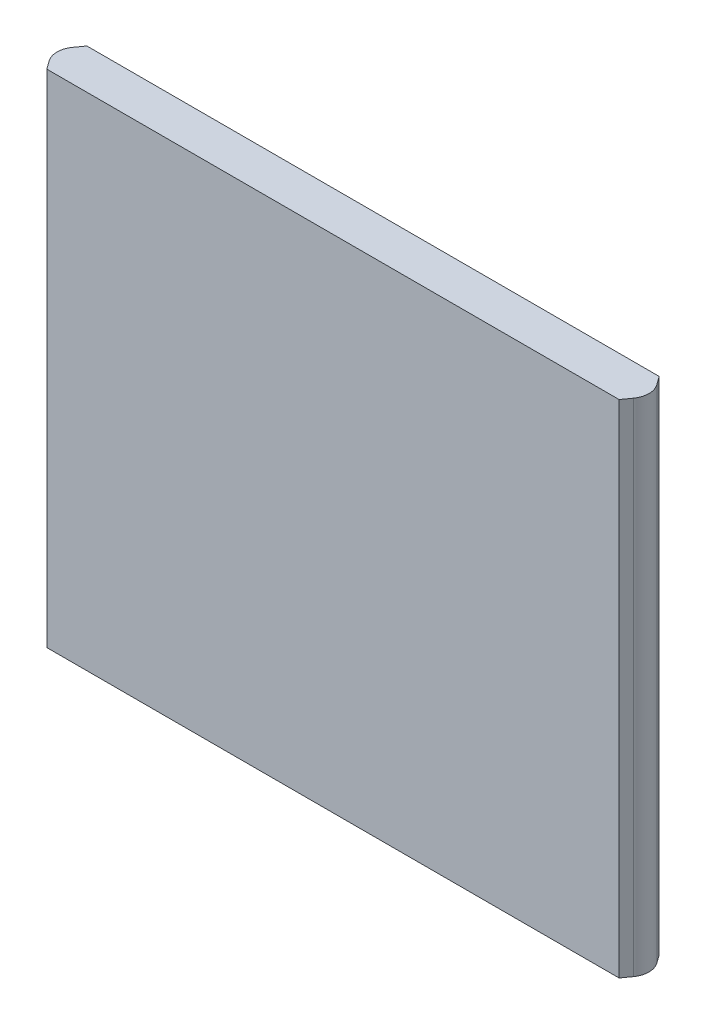
from build123d import *

# Parameters (mm, degrees)
SKETCH_1_W          = 30
SKETCH_1_H          = 25
EXTRUDE_1_DEPTH     = 2
CUT_EXTRUDE_1_DEPTH = 40.102429592
CUT_EXTRUDE_2_DEPTH = 3


with BuildPart() as part:
    # 草图1 → 凸台-拉伸1 (new body)
    with BuildSketch(Plane.XY):
        with Locations((15, -12.5)):
            Rectangle(SKETCH_1_W, SKETCH_1_H)
    extrude(amount=EXTRUDE_1_DEPTH)

    # 草图2 → 切除-拉伸1 (cut, through all)
    with BuildSketch(Plane.XZ.offset(25)):
        with BuildLine():
            Line((0.422813175, 1.585467977), (0.722179849, 2))
            Line((0.722179849, 2), (0, 2))
            Line((0, 2), (0, 1))
            Line((0, 1), (0, 0))
            Line((0, 0), (0.722179849, 0))
            Line((0.722179849, 0), (0.422813175, 0.414532023))
            ThreePointArc((0.422813175, 0.414532023), (0.233508708, 1), (0.422813175, 1.585467977))
        make_face()
        with BuildLine():
            Line((30, 0), (30, 1))
            Line((30, 1), (30, 2))
            Line((30, 2), (29.277820151, 2))
            Line((29.277820151, 2), (29.577186825, 1.585467977))
            ThreePointArc((29.577186825, 1.585467977), (29.766491292, 1), (29.577186825, 0.414532023))
            Line((29.577186825, 0.414532023), (29.277820151, 0))
            Line((29.277820151, 0), (30, 0))
        make_face()
    extrude(amount=-CUT_EXTRUDE_1_DEPTH, mode=Mode.SUBTRACT)

    # 草图3 → 切除-拉伸2 (cut)
    with BuildSketch(Plane.XZ.offset(25)):
        with BuildLine():
            ThreePointArc((15.3, 1), (15.212132034, 1.212132034), (15, 1.3))
            Line((15, 1.3), (15, 0.7))
            ThreePointArc((15, 0.7), (15.212132034, 0.787867966), (15.3, 1))
        make_face()
        with BuildLine():
            Line((15, 0.7), (15, 1.3))
            ThreePointArc((15, 1.3), (14.7, 1), (15, 0.7))
        make_face()
    extrude(amount=-CUT_EXTRUDE_2_DEPTH, mode=Mode.SUBTRACT)


solid = part.part
